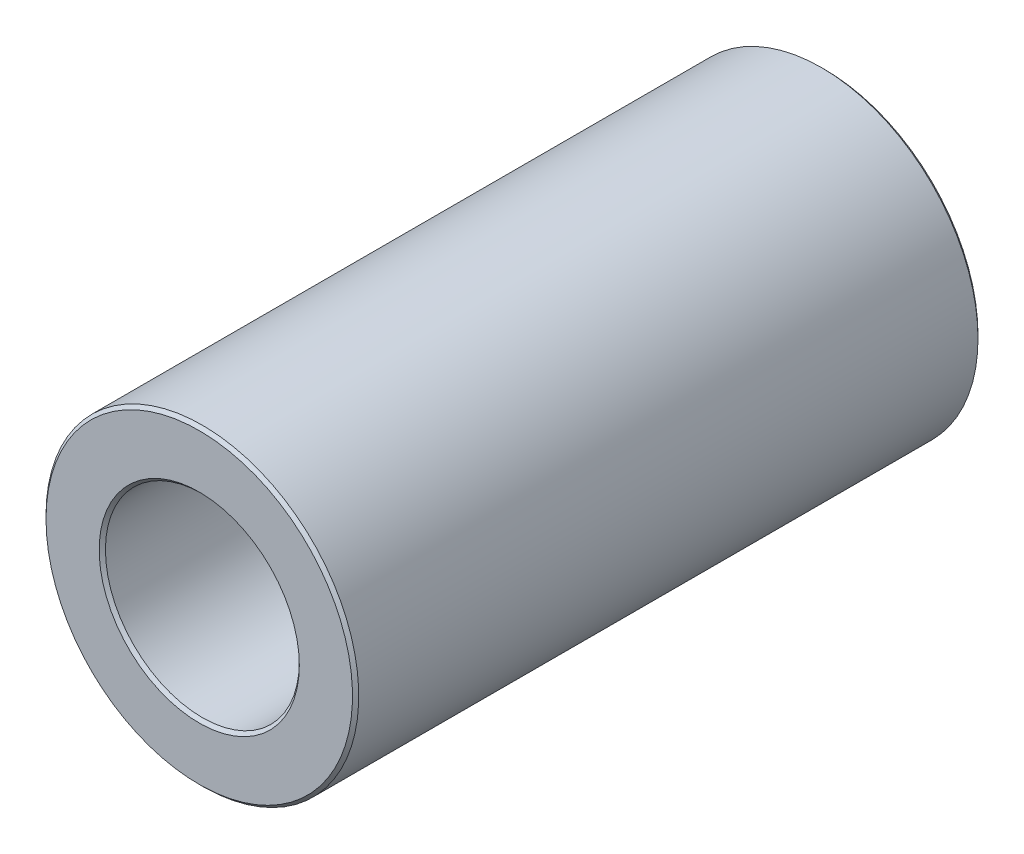
from build123d import *

# Parameters (mm, degrees)
SKETCH_1_R      = 2.5
SKETCH_1_R_2    = 1.55
EXTRUDE_1_DEPTH = 5
CHAMFER_1_SIZE  = 0.05


with BuildPart() as part:
    # 草图1 → 凸台-拉伸1 (new, symmetric)
    with BuildSketch(Plane.XY):
        Circle(SKETCH_1_R)
        Circle(SKETCH_1_R_2, mode=Mode.SUBTRACT)
    extrude(amount=EXTRUDE_1_DEPTH, both=True)

    # 倒角1
    chamfer_1_edges = [part.edges().sort_by_distance(p)[0] for p in [
        (-2.5, 0, -5),
        (-2.5, 0, 5),
        (-1.55, 0, -5),
        (-1.55, 0, 5),
    ]]
    chamfer(chamfer_1_edges, length=CHAMFER_1_SIZE)


solid = part.part
